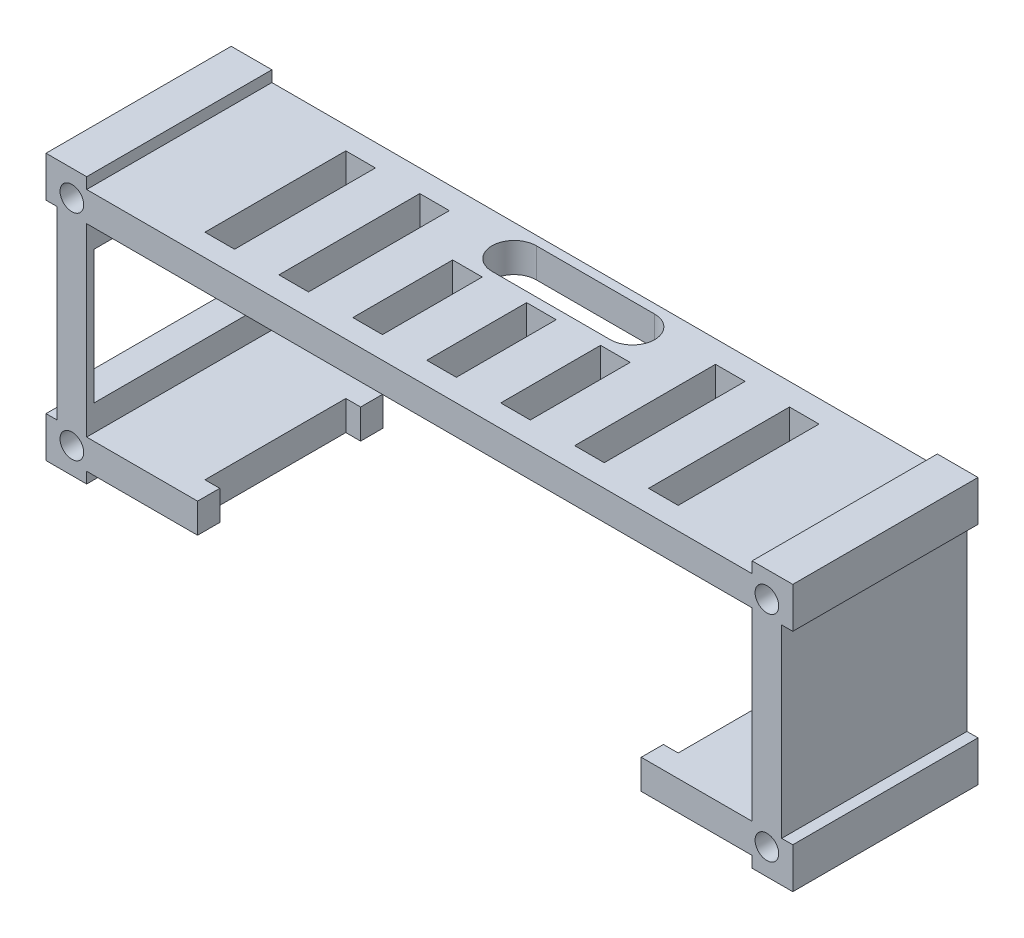
from build123d import *

# Parameters (mm, degrees)
SKETCH_1_W          = 98
SKETCH_1_H          = 33
SKETCH_1_W_2        = 90
SKETCH_1_H_2        = 25
EXTRUDE_1_DEPTH     = 25.05
SKETCH_2_W          = 5.5
SKETCH_2_H          = 5.5
EXTRUDE_2_DEPTH     = 25.05
SKETCH_3_W          = 5.5
SKETCH_3_H          = 5.5
EXTRUDE_3_DEPTH     = 25.05
SKETCH_4_W          = 5.5
SKETCH_4_H          = 5.5
EXTRUDE_4_DEPTH     = 25.05
SKETCH_5_W          = 5.5
SKETCH_5_H          = 5.5
EXTRUDE_5_DEPTH     = 25.05
SKETCH_6_R          = 1.6
CUT_EXTRUDE_1_DEPTH = 25.05
SKETCH_7_W          = 4
SKETCH_7_H          = 19.05
CUT_EXTRUDE_2_DEPTH = 4
SKETCH_8_W          = 4
SKETCH_8_H          = 19.05
SKETCH_8_H_2        = 13.5
CUT_EXTRUDE_3_DEPTH = 4
SKETCH_9_W          = 23.05
SKETCH_9_H          = 18
CUT_EXTRUDE_4_DEPTH = 4
SKETCH_10_W         = 60
SKETCH_10_H         = 4.5
CUT_EXTRUDE_5_DEPTH = 25.05
CUT_EXTRUDE_6_DEPTH = 4


with BuildPart() as part:
    # 草图1 → 凸台-拉伸1 (new body)
    with BuildSketch(Plane.XY.offset(-25.05)):
        Rectangle(SKETCH_1_W, SKETCH_1_H)
        Rectangle(SKETCH_1_W_2, SKETCH_1_H_2, mode=Mode.SUBTRACT)
    extrude(amount=EXTRUDE_1_DEPTH)

    # 草图2 → 凸台-拉伸2 (add)
    with BuildSketch(Plane.XY.offset(-25.05)):
        with Locations((47.75, 15.25)):
            Rectangle(SKETCH_2_W, SKETCH_2_H)
    extrude(amount=EXTRUDE_2_DEPTH)

    # 草图3 → 凸台-拉伸3 (add)
    with BuildSketch(Plane.XY.offset(-25.05)):
        with Locations((47.75, -15.25)):
            Rectangle(SKETCH_3_W, SKETCH_3_H)
    extrude(amount=EXTRUDE_3_DEPTH)

    # 草图4 → 凸台-拉伸4 (add)
    with BuildSketch(Plane.XY.offset(-25.05)):
        with Locations((-47.75, 15.25)):
            Rectangle(SKETCH_4_W, SKETCH_4_H)
    extrude(amount=EXTRUDE_4_DEPTH)

    # 草图5 → 凸台-拉伸5 (add)
    with BuildSketch(Plane.XY.offset(-25.05)):
        with Locations((-47.75, -15.25)):
            Rectangle(SKETCH_5_W, SKETCH_5_H)
    extrude(amount=EXTRUDE_5_DEPTH)

    # 草图6 → 切除-拉伸1 (cut)
    with BuildSketch(Plane.XY.offset(-25.05)):
        with Locations((-47, -14.5)):
            Circle(SKETCH_6_R)
        with Locations((-47, 14.5)):
            Circle(SKETCH_6_R)
        with Locations((47, -14.5)):
            Circle(SKETCH_6_R)
        with Locations((47, 14.5)):
            Circle(SKETCH_6_R)
    extrude(amount=CUT_EXTRUDE_1_DEPTH, mode=Mode.SUBTRACT)

    # 草图7 → 切除-拉伸2 (cut)
    with BuildSketch(Plane(origin=(0, -16.5, 0), x_dir=(1, 0, 0), z_dir=(0, 1, 0))):
        with Locations((-30, 12.525)):
            Rectangle(SKETCH_7_W, SKETCH_7_H)
        with Locations((-20, 12.525)):
            Rectangle(SKETCH_7_W, SKETCH_7_H)
        with Locations((-10, 12.525)):
            Rectangle(SKETCH_7_W, SKETCH_7_H)
        with Locations((0, 12.525)):
            Rectangle(SKETCH_7_W, SKETCH_7_H)
        with Locations((10, 12.525)):
            Rectangle(SKETCH_7_W, SKETCH_7_H)
        with Locations((20, 12.525)):
            Rectangle(SKETCH_7_W, SKETCH_7_H)
        with Locations((30, 12.525)):
            Rectangle(SKETCH_7_W, SKETCH_7_H)
    extrude(amount=CUT_EXTRUDE_2_DEPTH, mode=Mode.SUBTRACT)

    # 草图8 → 切除-拉伸3 (cut)
    with BuildSketch(Plane(origin=(0, 12.5, 0), x_dir=(1, 0, 0), z_dir=(0, 1, 0))):
        with Locations((-30, 12.525)):
            Rectangle(SKETCH_8_W, SKETCH_8_H)
        with Locations((-20, 12.525)):
            Rectangle(SKETCH_8_W, SKETCH_8_H)
        with Locations((-10, 9.75)):
            Rectangle(SKETCH_8_W, SKETCH_8_H_2)
        with Locations((0, 9.75)):
            Rectangle(SKETCH_8_W, SKETCH_8_H_2)
        with Locations((10, 9.75)):
            Rectangle(SKETCH_8_W, SKETCH_8_H_2)
        with Locations((20, 12.525)):
            Rectangle(SKETCH_8_W, SKETCH_8_H)
        with Locations((30, 12.525)):
            Rectangle(SKETCH_8_W, SKETCH_8_H)
    extrude(amount=CUT_EXTRUDE_3_DEPTH, mode=Mode.SUBTRACT)

    # 草图9 → 切除-拉伸4 (cut)
    with BuildSketch(Plane(origin=(-49, 0, 0), x_dir=(0, 0, -1), z_dir=(1, 0, 0))):
        with Locations((12.525, 0)):
            Rectangle(SKETCH_9_W, SKETCH_9_H)
    extrude(amount=CUT_EXTRUDE_4_DEPTH, mode=Mode.SUBTRACT)

    # 草图10 → 切除-拉伸5 (cut)
    with BuildSketch(Plane.XY.offset(-25.05)):
        with Locations((0, -14.75)):
            Rectangle(SKETCH_10_W, SKETCH_10_H)
    extrude(amount=CUT_EXTRUDE_5_DEPTH, mode=Mode.SUBTRACT)

    # 草图11 → 切除-拉伸6 (cut)
    with BuildSketch(Plane(origin=(0, 12.5, 0), x_dir=(1, 0, 0), z_dir=(0, 1, 0))):
        with BuildLine():
            Line((-8, 17.82), (8, 17.82))
            ThreePointArc((8, 17.82), (11, 20.82), (8, 23.82))
            Line((8, 23.82), (-8, 23.82))
            ThreePointArc((-8, 23.82), (-11, 20.82), (-8, 17.82))
        make_face()
    extrude(amount=CUT_EXTRUDE_6_DEPTH, mode=Mode.SUBTRACT)


solid = part.part
